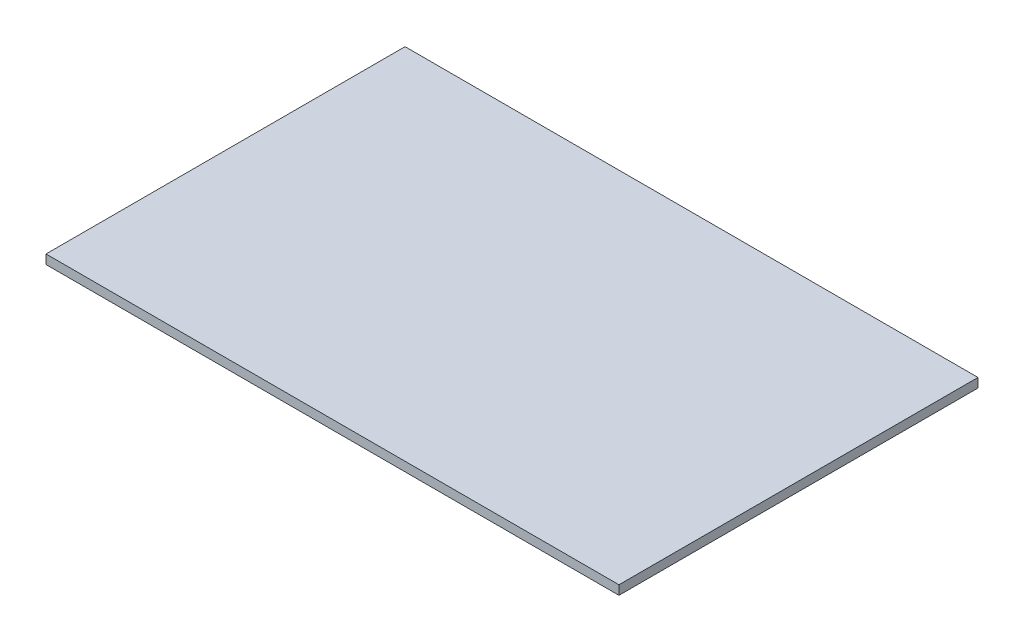
from build123d import *

# Parameters (mm, degrees)
SKETCH1_W           = 750
SKETCH1_H           = 470
BOSS_EXTRUDE1_DEPTH = 12


with BuildPart() as part:
    # Sketch1 → Boss-Extrude1 (new body)
    with BuildSketch(Plane(origin=(0, 0, 0), x_dir=(1, 0, 0), z_dir=(0, 1, 0))):
        Rectangle(SKETCH1_W, SKETCH1_H)
    extrude(amount=BOSS_EXTRUDE1_DEPTH)


solid = part.part
